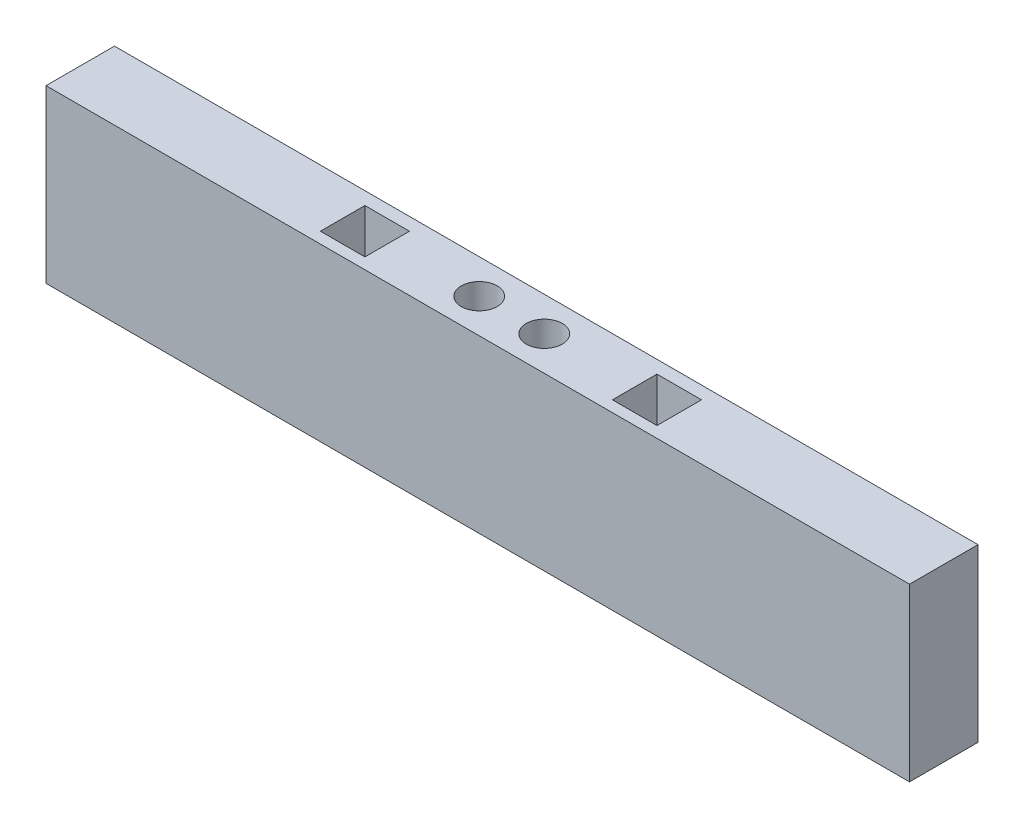
from build123d import *

# Parameters (mm, degrees)
BOSS_EXTRUDE1_DEPTH = 20
SKETCH5_R           = 5.25
CUT_EXTRUDE4_DEPTH  = 20
SKETCH6_W           = 13
SKETCH6_H           = 13
CUT_EXTRUDE5_DEPTH  = 15.5
SKETCH7_W           = 13
SKETCH7_H           = 13
CUT_EXTRUDE6_DEPTH  = 15.5
SKETCH8_W           = 300
SKETCH8_H           = 102
BOSS_EXTRUDE2_DEPTH = 20
CUT_EXTRUDE7_START  = -150
SKETCH9_W           = 47.842391085
SKETCH9_H           = 20
CUT_EXTRUDE7_DEPTH  = 150
SKETCH10_W          = 252.157608915
SKETCH10_H          = 50
CUT_EXTRUDE8_DEPTH  = 310
SKETCH11_W          = 252.157608915
SKETCH11_H          = 50
CUT_EXTRUDE9_DEPTH  = 20


with BuildPart() as part:
    # Sketch1 → Boss-Extrude1 (new body)
    with BuildSketch(Plane.XY):
        Polygon((-107.821386225, 92.09039548), (-7.821386225, 92.09039548), (117.178613775, 92.09039548), (117.178613775, 44.09039548), (-7.821386225, 44.09039548), (-107.821386225, 44.09039548), (-182.821386225, 44.09039548), (-182.821386225, 92.09039548), align=None)
    extrude(amount=BOSS_EXTRUDE1_DEPTH)

    # Sketch5 → Cut-Extrude4 (cut)
    with BuildSketch(Plane(origin=(0, 92.09039548, 0), x_dir=(1, 0, 0), z_dir=(0, 1, 0))):
        with Locations(Location((-66.321386225, -10, 0), (0, 0, 180))):
            Circle(SKETCH5_R)
        with Locations(Location((-47.321386225, -10, 0), (0, 0, 180))):
            Circle(SKETCH5_R)
    extrude(amount=-CUT_EXTRUDE4_DEPTH, mode=Mode.SUBTRACT)

    # Sketch6 → Cut-Extrude5 (cut)
    with BuildSketch(Plane(origin=(0, 92.09039548, 0), x_dir=(1, 0, 0), z_dir=(0, 1, 0))):
        with Locations((-99.441386225, -10.25)):
            Rectangle(SKETCH6_W, SKETCH6_H)
    extrude(amount=-CUT_EXTRUDE5_DEPTH, mode=Mode.SUBTRACT)

    # Sketch7 → Cut-Extrude6 (cut)
    with BuildSketch(Plane(origin=(0, 92.09039548, 0), x_dir=(1, 0, 0), z_dir=(0, 1, 0))):
        with Locations((-14.16377731, -10.25)):
            Rectangle(SKETCH7_W, SKETCH7_H)
    extrude(amount=-CUT_EXTRUDE6_DEPTH, mode=Mode.SUBTRACT)

    # Sketch8 → Boss-Extrude2 (add)
    with BuildSketch(Plane.XY.offset(20)):
        with Locations((-32.821386225, -6.90960452)):
            Rectangle(SKETCH8_W, SKETCH8_H)
    extrude(amount=-BOSS_EXTRUDE2_DEPTH)

    # Sketch9 → Cut-Extrude7 (cut)
    with BuildSketch(Plane(origin=(0, 92.09039548, 0), x_dir=(1, 0, 0), z_dir=(0, 1, 0)).offset(CUT_EXTRUDE7_START)):
        with Locations((93.257418233, -10)):
            Rectangle(SKETCH9_W, SKETCH9_H)
    extrude(amount=CUT_EXTRUDE7_DEPTH, mode=Mode.SUBTRACT)

    # Sketch10 → Cut-Extrude8 (cut)
    with BuildSketch(Plane(origin=(0, 0, 0), x_dir=(-1, 0, 0), z_dir=(0, 0, -1))):
        with Locations((56.742581767, -32.90960452)):
            Rectangle(SKETCH10_W, SKETCH10_H)
    extrude(amount=-CUT_EXTRUDE8_DEPTH, mode=Mode.SUBTRACT)

    # Sketch11 → Cut-Extrude9 (cut)
    with BuildSketch(Plane(origin=(0, 0, 0), x_dir=(-1, 0, 0), z_dir=(0, 0, -1))):
        with Locations((56.742581767, 17.09039548)):
            Rectangle(SKETCH11_W, SKETCH11_H)
    extrude(amount=-CUT_EXTRUDE9_DEPTH, mode=Mode.SUBTRACT)


solid = part.part
